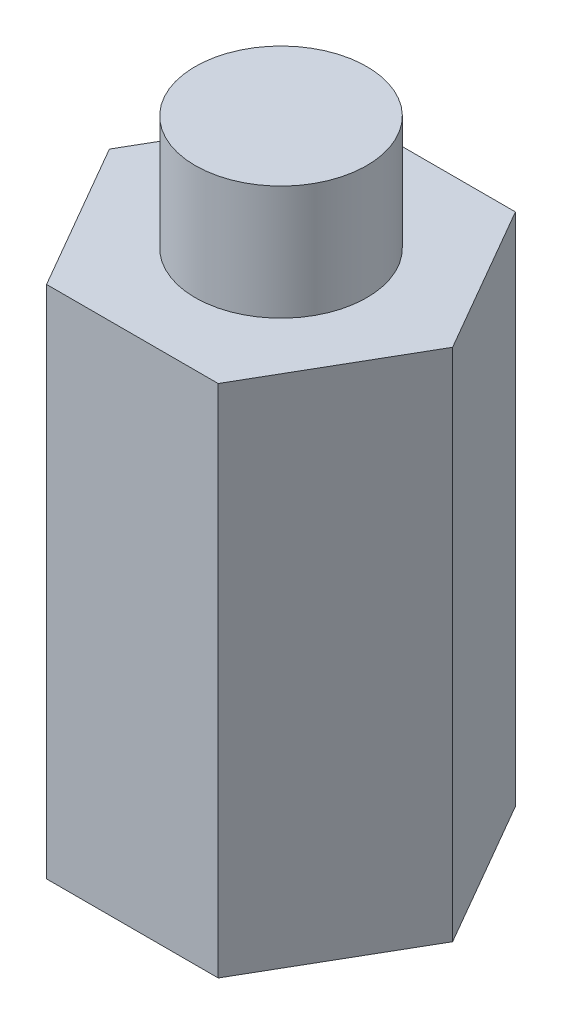
from build123d import *

# Parameters (mm, degrees)
SKETCH_1_R           = 1.5
EXTRUDE_1_DEPTH      = 9
EXTRUDE_2_DEPTH      = 2
EXTRUDE_2_DEPTH_BACK = 1
SKETCH_2_R           = 1.5


with BuildPart() as part:
    # 草图1 → 凸台-拉伸1 (new body)
    with BuildSketch(Plane(origin=(0, 0, 0), x_dir=(1, 0, 0), z_dir=(0, 1, 0))):
        Polygon((3, 0), (1.5, 2.598076211), (-1.5, 2.598076211), (-3, 0), (-1.5, -2.598076211), (1.5, -2.598076211), align=None)
        with Locations(Location((0, 0, 0), (0, 0, 270))):
            Circle(SKETCH_1_R, mode=Mode.SUBTRACT)
    extrude(amount=EXTRUDE_1_DEPTH)

    # 草图2 → 凸台-拉伸2 (add, two sides: drawn at the far end of the back side and taken through both)
    with BuildSketch(Plane(origin=(0, 9, 0), x_dir=(1, 0, 0), z_dir=(0, 1, 0)).offset(-EXTRUDE_2_DEPTH_BACK)):
        with Locations(Location((0, 0, 0), (0, 0, 270))):
            Circle(SKETCH_2_R)
    extrude(amount=EXTRUDE_2_DEPTH + EXTRUDE_2_DEPTH_BACK)


solid = part.part
